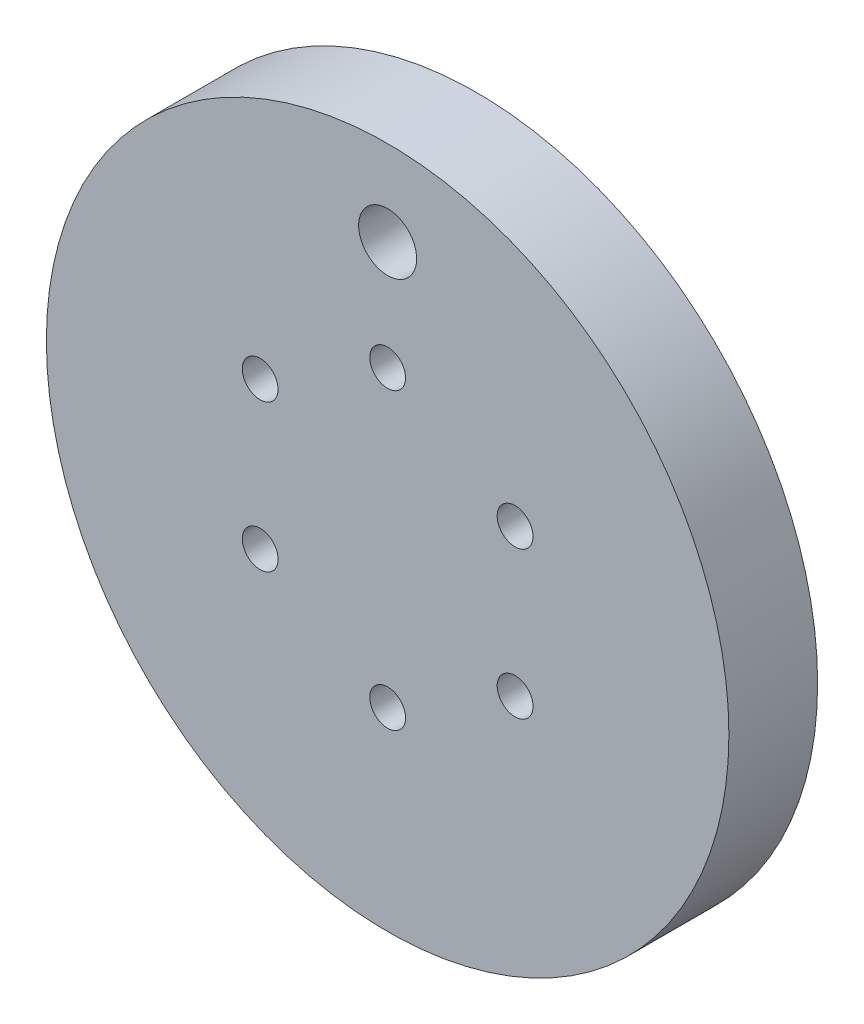
from build123d import *

# Parameters (mm, degrees)
SKETCH_1_R          = 40
SKETCH_1_R_2        = 2.1
EXTRUDE_1_DEPTH     = 10.4
SKETCH_2_R          = 3.4
CUT_EXTRUDE_1_DEPTH = 58.516606298


with BuildPart() as part:
    # 草图1 → 凸台-拉伸1 (new body)
    with BuildSketch(Plane.XY):
        Circle(SKETCH_1_R)
        with Locations((0, 17.25)):
            Circle(SKETCH_1_R_2, mode=Mode.SUBTRACT)
        with Locations((14.938938215, 8.625)):
            Circle(SKETCH_1_R_2, mode=Mode.SUBTRACT)
        with Locations((14.938938215, -8.625)):
            Circle(SKETCH_1_R_2, mode=Mode.SUBTRACT)
        with Locations((0, -17.25)):
            Circle(SKETCH_1_R_2, mode=Mode.SUBTRACT)
        with Locations((-14.938938215, -8.625)):
            Circle(SKETCH_1_R_2, mode=Mode.SUBTRACT)
        with Locations((-14.938938215, 8.625)):
            Circle(SKETCH_1_R_2, mode=Mode.SUBTRACT)
    extrude(amount=EXTRUDE_1_DEPTH)

    # 草图2 → 切除-拉伸1 (cut, through all)
    with BuildSketch(Plane.XY.offset(10.4)):
        with Locations((0, 30)):
            Circle(SKETCH_2_R)
    extrude(amount=-CUT_EXTRUDE_1_DEPTH, mode=Mode.SUBTRACT)


solid = part.part
